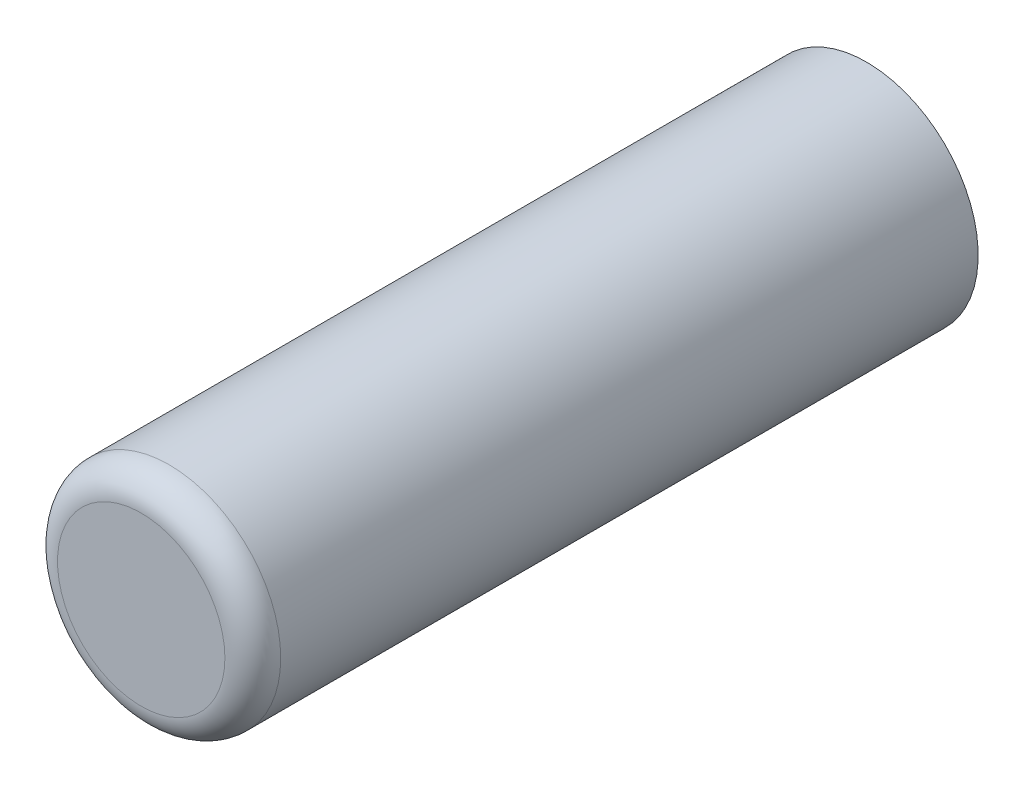
from build123d import *

# Parameters (mm, degrees)
SKETCH1_R           = 2
BOSS_EXTRUDE1_DEPTH = 13
FILLET1_R           = 0.5


with BuildPart() as part:
    # Sketch1 → Boss-Extrude1 (new body)
    with BuildSketch(Plane.XY):
        with Locations(Location((0, 0, 0), (0, 0, 180))):
            Circle(SKETCH1_R)
    extrude(amount=BOSS_EXTRUDE1_DEPTH)

    # Fillet1
    fillet1_edges = [part.edges().sort_by_distance(p)[0] for p in [
        (2, 0, 13),
    ]]
    fillet(fillet1_edges, radius=FILLET1_R)


solid = part.part
